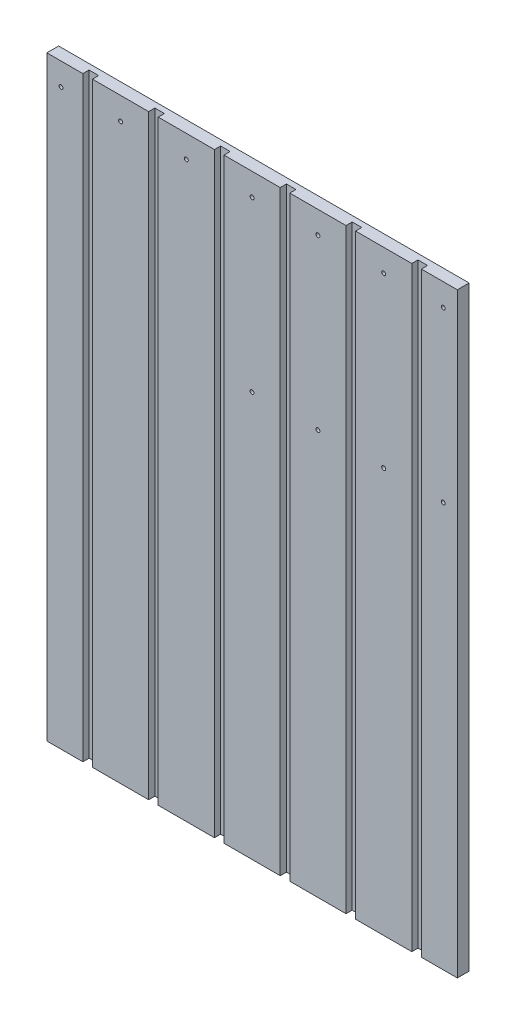
from build123d import *

# Parameters (mm, degrees)
SKIZZE1_W                       = 730
SKIZZE1_H                       = 1060
AUFSATZ_LINEAR_AUSTRAGEN1_DEPTH = 21
SKIZZE2_W                       = 17
SKIZZE2_H                       = 1060
SCHNITT_LINEAR_AUSTRAGEN1_DEPTH = 11
SKIZZE3_R                       = 3.5
SCHNITT_LINEAR_AUSTRAGEN2_DEPTH = 40


with BuildPart() as part:
    # Skizze1 → Aufsatz-Linear austragen1 (new body)
    with BuildSketch(Plane.XY):
        Rectangle(SKIZZE1_W, SKIZZE1_H)
    extrude(amount=AUFSATZ_LINEAR_AUSTRAGEN1_DEPTH)

    # Skizze2 → Schnitt-Linear austragen1 (cut)
    with BuildSketch(Plane.XY.offset(21)):
        with Locations((58.5, 0)):
            Rectangle(SKIZZE2_W, SKIZZE2_H)
        with Locations((175.5, 0)):
            Rectangle(SKIZZE2_W, SKIZZE2_H)
        with Locations((292.5, 0)):
            Rectangle(SKIZZE2_W, SKIZZE2_H)
        with Locations((-292.5, 0)):
            Rectangle(SKIZZE2_W, SKIZZE2_H)
        with Locations((-175.5, 0)):
            Rectangle(SKIZZE2_W, SKIZZE2_H)
        with Locations((-58.5, 0)):
            Rectangle(SKIZZE2_W, SKIZZE2_H)
    extrude(amount=-SCHNITT_LINEAR_AUSTRAGEN1_DEPTH, mode=Mode.SUBTRACT)

    # Skizze3 → Schnitt-Linear austragen2 (cut)
    with BuildSketch(Plane.XY.offset(21)):
        with Locations((0, 490)):
            Circle(SKIZZE3_R)
        with Locations((117, 490)):
            Circle(SKIZZE3_R)
        with Locations((234, 490)):
            Circle(SKIZZE3_R)
        with Locations((340, 490)):
            Circle(SKIZZE3_R)
        with Locations((340, 190)):
            Circle(SKIZZE3_R)
        with Locations((234, 190)):
            Circle(SKIZZE3_R)
        with Locations((117, 190)):
            Circle(SKIZZE3_R)
        with Locations((0, 190)):
            Circle(SKIZZE3_R)
        with Locations(Location((-340, 490, 0), (0, 0, 180))):
            Circle(SKIZZE3_R)
        with Locations(Location((-234, 490, 0), (0, 0, 180))):
            Circle(SKIZZE3_R)
        with Locations(Location((-117, 490, 0), (0, 0, 180))):
            Circle(SKIZZE3_R)
    extrude(amount=-SCHNITT_LINEAR_AUSTRAGEN2_DEPTH, mode=Mode.SUBTRACT)


solid = part.part
